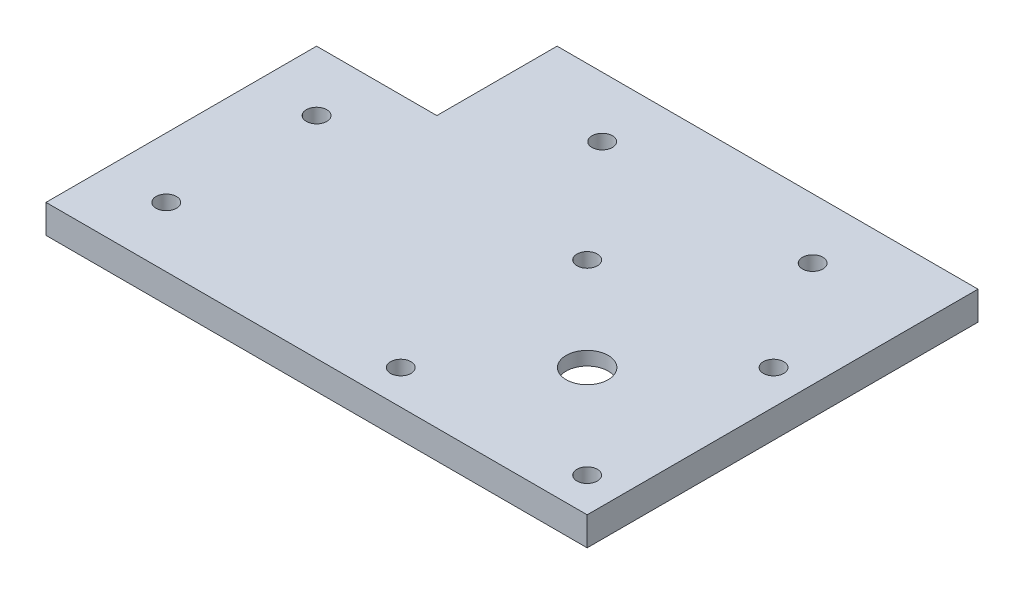
from build123d import *

# Parameters (mm, degrees)
BOSS_EXTRUDE1_DEPTH      = 4.7625
F_7_0_7_DIAMETER_HOLE1_D = 7
SKETCH12_R               = 11.5
CUT_EXTRUDE1_DEPTH       = 2.5
M3_CLEARANCE_HOLE1_D     = 3.4


with BuildPart() as part:
    # Sketch1 → Boss-Extrude1 (new body)
    with BuildSketch(Plane(origin=(0, 0, 0), x_dir=(1, 0, 0), z_dir=(0, 1, 0))):
        Polygon((0, 0), (0, 45), (20, 45), (20, 65), (90, 65), (90, 0), align=None)
    extrude(amount=BOSS_EXTRUDE1_DEPTH)

    # Ø7.0 (7) Diameter Hole1 (through all)
    with Locations(Plane(origin=(0, 0, 0), x_dir=(-1, 0, 0), z_dir=(0, -1, 0))):
        with Locations((-68.791, 21.209)):
            Hole(F_7_0_7_DIAMETER_HOLE1_D / 2)

    # Sketch12 → Cut-Extrude1 (cut)
    with BuildSketch(Plane.XZ):
        with Locations(Location((68.791, -21.209, 0), (0, 0, 270))):
            Circle(SKETCH12_R)
    extrude(amount=-CUT_EXTRUDE1_DEPTH, mode=Mode.SUBTRACT)

    # M3 Clearance Hole1 (through all)
    with Locations(Plane(origin=(0, 0, 0), x_dir=(-1, 0, 0), z_dir=(0, -1, 0))):
        with Locations((-10, 10), (-10, 35), (-37.5, 55), (-72.5, 55), (-84.291, 36.709), (-84.291, 5.709), (-53.291, 5.709), (-53.291, 36.709)):
            Hole(M3_CLEARANCE_HOLE1_D / 2)


solid = part.part
